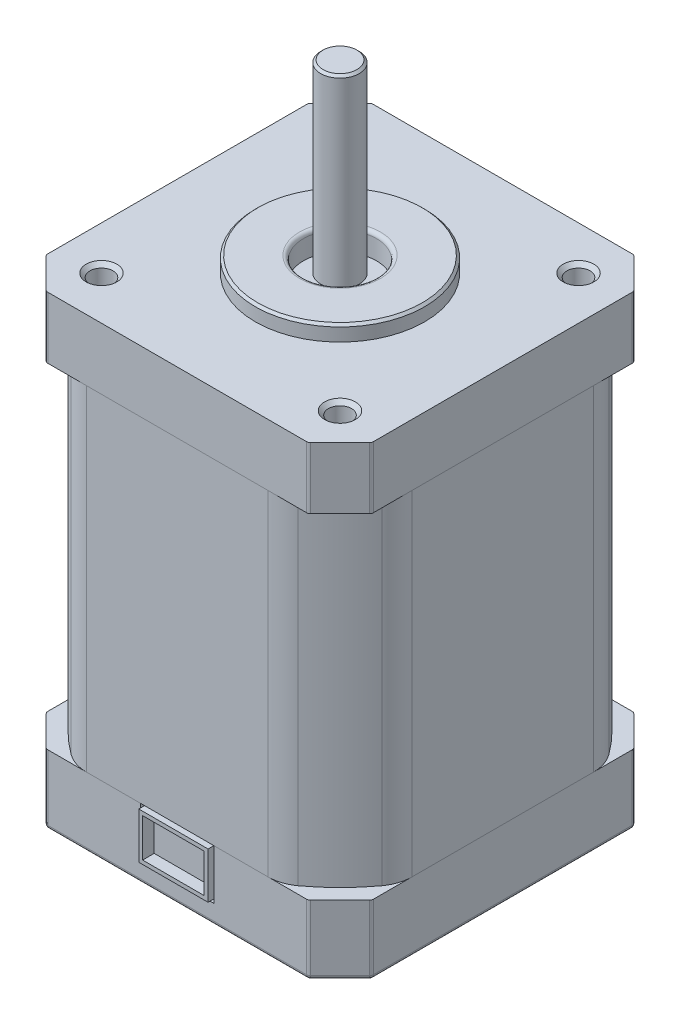
from build123d import *

# Parameters (mm, degrees)
EXTRUDE_1_DEPTH     = 9
EXTRUDE_START       = 60.5
EXTRUDE_2_DEPTH     = 8
EXTRUDE_3_DEPTH     = 43.5
SKETCH_3_R          = 4.75
CUT_EXTRUDE_1_DEPTH = 3
SKETCH_4_R          = 4.75
SKETCH_4_R_2        = 2.5
CUT_EXTRUDE_2_DEPTH = 0.5
SKETCH_5_R          = 0.5
CUT_EXTRUDE_3_DEPTH = 0.5
CHAMFER_1_SIZE      = 0.3
FILLET_1_R          = 0.5
FILLET_2_R          = 0.5
SKETCH_6_R          = 11
SKETCH_6_R_2        = 4.75
EXTRUDE_4_DEPTH     = 2
CUT_EXTRUDE_START   = -1
SKETCH_7_R          = 4.75
CUT_EXTRUDE_4_DEPTH = 1
CHAMFER_2_SIZE      = 0.3
FILLET_3_R          = 0.5
SKETCH_8_R          = 2.5
EXTRUDE_5_DEPTH     = 24
CHAMFER_4_SIZE      = 0.3
SKETCH_10_W         = 9.5
SKETCH_10_H         = 6.5
CUT_EXTRUDE_6_DEPTH = 1
SKETCH_11_W         = 9
SKETCH_11_H         = 6
SKETCH_11_W_2       = 8
SKETCH_11_H_2       = 5
EXTRUDE_6_DEPTH     = 1.5
SKETCH_16_R         = 1.5
CUT_EXTRUDE_9_DEPTH = 7
CHAMFER_35_SIZE     = 0.5


with BuildPart() as part:
    # Эскиз1 → Бобышка-Вытянуть1 (new body)
    with BuildSketch(Plane(origin=(0, 0, 0), x_dir=(1, 0, 0), z_dir=(0, 1, 0))):
        Polygon((-17.033766184, 21.15), (-21.15, 17.033766184), (-21.15, -17.033766184), (-17.033766184, -21.15), (17.033766184, -21.15), (21.15, -17.033766184), (21.15, 17.033766184), (17.033766184, 21.15), align=None)
    extrude(amount=EXTRUDE_1_DEPTH)

    # Эскиз3 → Вырез-Вытянуть1 (cut)
    with BuildSketch(Plane.XZ):
        Circle(SKETCH_3_R)
    extrude(amount=-CUT_EXTRUDE_1_DEPTH, mode=Mode.SUBTRACT)

    # Эскиз4 → Вырез-Вытянуть2 (cut)
    with BuildSketch(Plane.XZ.offset(-3)):
        Circle(SKETCH_4_R)
        Circle(SKETCH_4_R_2, mode=Mode.SUBTRACT)
    extrude(amount=-CUT_EXTRUDE_2_DEPTH, mode=Mode.SUBTRACT)

    # Эскиз5 → Вырез-Вытянуть3 (cut)
    with BuildSketch(Plane.XZ.offset(-3)):
        Circle(SKETCH_5_R)
    extrude(amount=-CUT_EXTRUDE_3_DEPTH, mode=Mode.SUBTRACT)

    # Фаска1
    chamfer_1_edges = [part.edges().sort_by_distance(p)[0] for p in [
        (-2.5, 3, 0),
    ]]
    chamfer(chamfer_1_edges, length=CHAMFER_1_SIZE)

    # Скругление1
    fillet_1_edges = [part.edges().sort_by_distance(p)[0] for p in [
        (0, 0, 21.15),
        (19.091883092, 0, 19.091883092),
        (21.15, 0, 0),
        (19.091883092, 0, -19.091883092),
        (0, 0, -21.15),
        (-19.091883092, 0, -19.091883092),
        (-21.15, 0, 0),
        (-19.091883092, 0, 19.091883092),
        (-4.75, 0, 0),
        (21.15, 4.5, 17.033766184),
        (17.033766184, 4.5, 21.15),
        (-17.033766184, 4.5, 21.15),
        (-21.15, 4.5, 17.033766184),
        (-21.15, 4.5, -17.033766184),
        (-17.033766184, 4.5, -21.15),
        (17.033766184, 4.5, -21.15),
        (21.15, 4.5, -17.033766184),
    ]]
    fillet(fillet_1_edges, radius=FILLET_1_R)

    # Эскиз10 → Вырез-Вытянуть6 (cut)
    with BuildSketch(Plane.XY.offset(21.15)):
        with Locations((0, 5.75)):
            Rectangle(SKETCH_10_W, SKETCH_10_H)
    extrude(amount=-CUT_EXTRUDE_6_DEPTH, mode=Mode.SUBTRACT)


with BuildPart() as body_2:
    # Эскиз1<3> → Бобышка-Вытянуть2 (new body)
    with BuildSketch(Plane(origin=(0, 0, 0), x_dir=(1, 0, 0), z_dir=(0, 1, 0)).offset(EXTRUDE_START)):
        Polygon((-17.033766184, 21.15), (-21.15, 17.033766184), (-21.15, -17.033766184), (-17.033766184, -21.15), (17.033766184, -21.15), (21.15, -17.033766184), (21.15, 17.033766184), (17.033766184, 21.15), align=None)
    extrude(amount=-EXTRUDE_2_DEPTH)

    # Скругление2
    fillet_2_edges = [body_2.edges().sort_by_distance(p)[0] for p in [
        (21.15, 56.5, 17.033766184),
        (17.033766184, 56.5, 21.15),
        (-17.033766184, 56.5, 21.15),
        (-21.15, 56.5, 17.033766184),
        (-21.15, 56.5, -17.033766184),
        (-17.033766184, 56.5, -21.15),
        (17.033766184, 56.5, -21.15),
        (21.15, 56.5, -17.033766184),
    ]]
    fillet(fillet_2_edges, radius=FILLET_2_R)

    # Эскиз6 → Бобышка-Вытянуть4 (add)
    with BuildSketch(Plane(origin=(0, 60.5, 0), x_dir=(1, 0, 0), z_dir=(0, 1, 0))):
        Circle(SKETCH_6_R)
        Circle(SKETCH_6_R_2, mode=Mode.SUBTRACT)
    extrude(amount=EXTRUDE_4_DEPTH)

    # Эскиз7 → Вырез-Вытянуть4 (cut)
    with BuildSketch(Plane(origin=(0, 60.5, 0), x_dir=(1, 0, 0), z_dir=(0, 1, 0)).offset(CUT_EXTRUDE_START)):
        Circle(SKETCH_7_R)
    extrude(amount=CUT_EXTRUDE_4_DEPTH, mode=Mode.SUBTRACT)

    # Фаска2
    chamfer_2_edges = [body_2.edges().sort_by_distance(p)[0] for p in [
        (-11, 62.5, 0),
    ]]
    chamfer(chamfer_2_edges, length=CHAMFER_2_SIZE)

    # Скругление3
    fillet_3_edges = [body_2.edges().sort_by_distance(p)[0] for p in [
        (-4.75, 62.5, 0),
    ]]
    fillet(fillet_3_edges, radius=FILLET_3_R)

    # Эскиз16 → Вырез-Вытянуть9 (cut)
    with BuildSketch(Plane(origin=(0, 60.5, 0), x_dir=(1, 0, 0), z_dir=(0, 1, 0))):
        with Locations((-15.5, 15.5)):
            Circle(SKETCH_16_R)
        with Locations((15.5, 15.5)):
            Circle(SKETCH_16_R)
        with Locations((15.5, -15.5)):
            Circle(SKETCH_16_R)
        with Locations((-15.5, -15.5)):
            Circle(SKETCH_16_R)
    extrude(amount=-CUT_EXTRUDE_9_DEPTH, mode=Mode.SUBTRACT)

    # Фаска35
    chamfer_35_edges = [body_2.edges().sort_by_distance(p)[0] for p in [
        (-17, 60.5, 15.5),
        (14, 60.5, 15.5),
        (14, 60.5, -15.5),
        (-17, 60.5, -15.5),
    ]]
    chamfer(chamfer_35_edges, length=CHAMFER_35_SIZE)


with BuildPart() as body_3:
    # Эскиз2 → Бобышка-Вытянуть3 (new body)
    with BuildSketch(Plane(origin=(0, 9, 0), x_dir=(1, 0, 0), z_dir=(0, 1, 0))):
        with BuildLine():
            Line((-11.797351398, -21.15), (11.797351398, -21.15))
            ThreePointArc((11.797351398, -21.15), (13.348560603, -20.903288335), (14.746689247, -20.1875))
            ThreePointArc((14.746689247, -20.1875), (17.67766953, -17.67766953), (20.1875, -14.746689247))
            ThreePointArc((20.1875, -14.746689247), (20.903288335, -13.348560603), (21.15, -11.797351398))
            Line((21.15, -11.797351398), (21.15, 11.797351398))
            ThreePointArc((21.15, 11.797351398), (20.903288335, 13.348560603), (20.1875, 14.746689247))
            ThreePointArc((20.1875, 14.746689247), (17.67766953, 17.67766953), (14.746689247, 20.1875))
            ThreePointArc((14.746689247, 20.1875), (13.348560603, 20.903288335), (11.797351398, 21.15))
            Line((11.797351398, 21.15), (-11.797351398, 21.15))
            ThreePointArc((-11.797351398, 21.15), (-13.348560603, 20.903288335), (-14.746689247, 20.1875))
            ThreePointArc((-14.746689247, 20.1875), (-17.67766953, 17.67766953), (-20.1875, 14.746689247))
            ThreePointArc((-20.1875, 14.746689247), (-20.903288335, 13.348560603), (-21.15, 11.797351398))
            Line((-21.15, 11.797351398), (-21.15, -11.797351398))
            ThreePointArc((-21.15, -11.797351398), (-20.903288335, -13.348560603), (-20.1875, -14.746689247))
            ThreePointArc((-20.1875, -14.746689247), (-17.67766953, -17.67766953), (-14.746689247, -20.1875))
            ThreePointArc((-14.746689247, -20.1875), (-13.348560603, -20.903288335), (-11.797351398, -21.15))
        make_face()
    extrude(amount=EXTRUDE_3_DEPTH)


with BuildPart() as body_4:
    # Эскиз8 → Бобышка-Вытянуть5 (new body)
    with BuildSketch(Plane(origin=(0, 60.5, 0), x_dir=(1, 0, 0), z_dir=(0, 1, 0))):
        Circle(SKETCH_8_R)
    extrude(amount=EXTRUDE_5_DEPTH)

    # Фаска4
    chamfer_4_edges = [body_4.edges().sort_by_distance(p)[0] for p in [
        (-2.5, 84.5, 0),
    ]]
    chamfer(chamfer_4_edges, length=CHAMFER_4_SIZE)


with BuildPart() as body_5:
    # Эскиз11 → Бобышка-Вытянуть6 (new body)
    with BuildSketch(Plane.XY.offset(20.15)):
        with Locations((0, 5.75)):
            Rectangle(SKETCH_11_W, SKETCH_11_H)
        with Locations((0, 5.75)):
            Rectangle(SKETCH_11_W_2, SKETCH_11_H_2, mode=Mode.SUBTRACT)
    extrude(amount=EXTRUDE_6_DEPTH)


solid = Compound([part.part, body_2.part, body_3.part, body_4.part, body_5.part])
